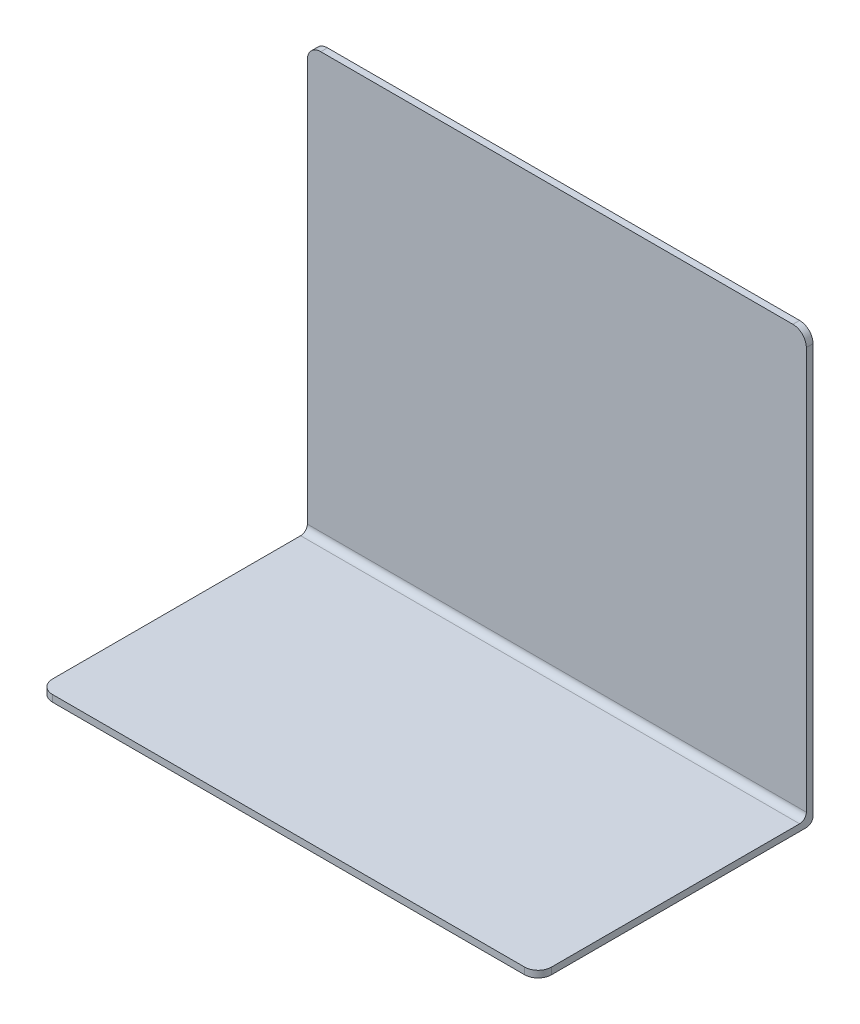
from build123d import *

# Parameters (mm, degrees)
SKETCH2_W           = 236.22
SKETCH2_H           = 203.2
BOSS_EXTRUDE1_DEPTH = 3.175
SKETCH3_W           = 236.22
SKETCH3_H           = 3.175
BOSS_EXTRUDE2_DEPTH = 127
FILLET1_R           = 3.175
FILLET2_R           = 6.35


with BuildPart() as part:
    # Sketch2 → Boss-Extrude1 (new body)
    with BuildSketch(Plane.XY):
        Rectangle(SKETCH2_W, SKETCH2_H)
    extrude(amount=BOSS_EXTRUDE1_DEPTH)

    # Sketch3 → Boss-Extrude2 (add)
    with BuildSketch(Plane.XY.offset(3.175)):
        with Locations((0, -100.0125)):
            Rectangle(SKETCH3_W, SKETCH3_H)
    extrude(amount=BOSS_EXTRUDE2_DEPTH)

    # Fillet1
    fillet1_edges = [part.edges().sort_by_distance(p)[0] for p in [
        (0, -98.425, 3.175),
        (0, -101.6, 0),
    ]]
    fillet(fillet1_edges, radius=FILLET1_R)

    # Fillet2
    fillet2_edges = [part.edges().sort_by_distance(p)[0] for p in [
        (-118.11, -100.0125, 130.175),
        (118.11, -100.0125, 130.175),
        (-118.11, 101.6, 1.5875),
        (118.11, 101.6, 1.5875),
    ]]
    fillet(fillet2_edges, radius=FILLET2_R)


solid = part.part
